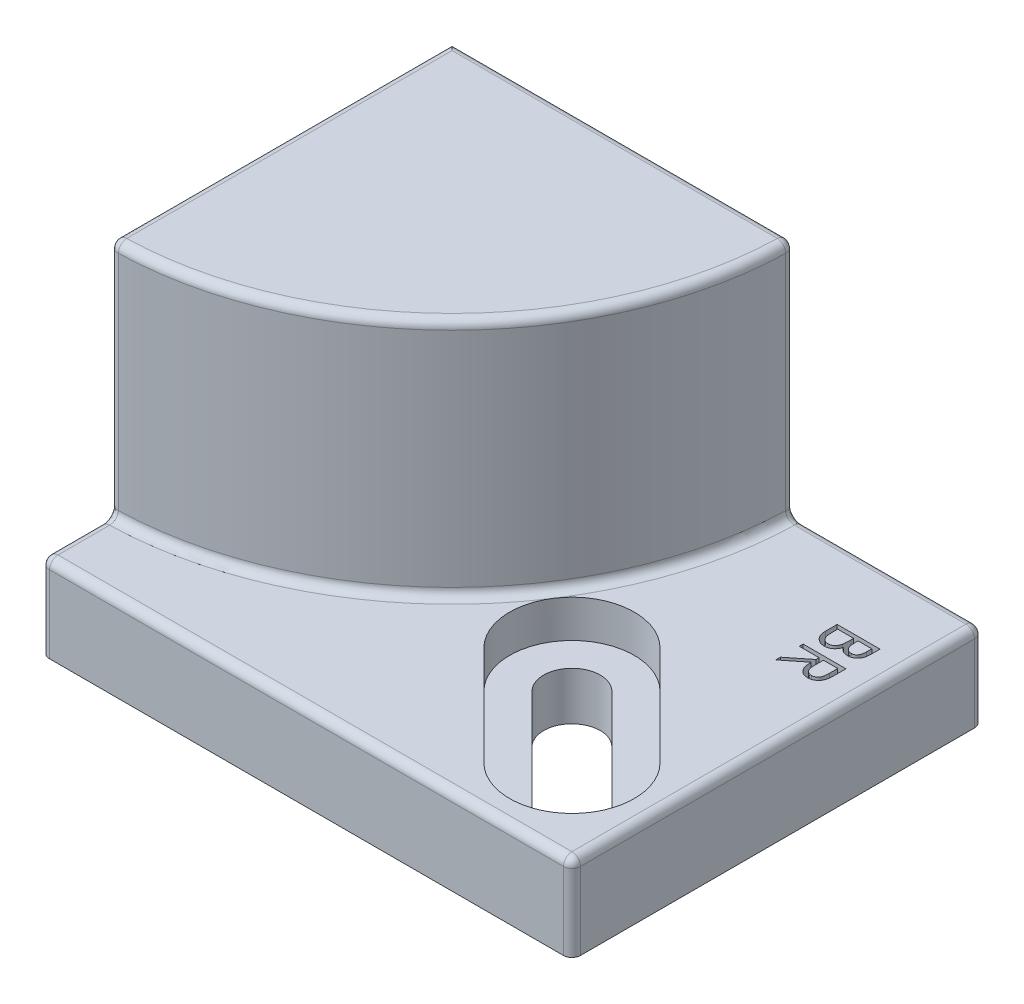
from build123d import *

# Parameters (mm, degrees)
SKETCH3_W                               = 62
SKETCH3_H                               = 48
BOSS_EXTRUDE1_DEPTH                     = 10
CBORE_FOR_M6_HEX_HEAD_BOLT1_D           = 6.6
CBORE_FOR_M6_HEX_HEAD_BOLT1_CBORE_D     = 14.55
CBORE_FOR_M6_HEX_HEAD_BOLT1_CBORE_DEPTH = 4.38
BOSS_EXTRUDE3_DEPTH                     = 18
BOSS_EXTRUDE4_DEPTH                     = 10
SKETCH10_R                              = 3
CUT_EXTRUDE2_DEPTH                      = 6
FILLET1_R                               = 1
CUT_EXTRUDE3_DEPTH                      = 4.38
CUT_EXTRUDE4_DEPTH                      = 51.847462188
CUT_EXTRUDE5_DEPTH                      = 2


with BuildPart() as part:
    # Sketch3 → Boss-Extrude1 (new body)
    with BuildSketch(Plane(origin=(0, 0, 0), x_dir=(1, 0, 0), z_dir=(0, 1, 0))):
        Rectangle(SKETCH3_W, SKETCH3_H)
    extrude(amount=BOSS_EXTRUDE1_DEPTH)

    # CBORE for M6 Hex Head Bolt1 (through all)
    with Locations(Plane(origin=(0, 10, 0), x_dir=(1, 0, 0), z_dir=(0, 1, 0))):
        with Locations((21, -14)):
            CounterBoreHole(CBORE_FOR_M6_HEX_HEAD_BOLT1_D / 2, CBORE_FOR_M6_HEX_HEAD_BOLT1_CBORE_D / 2, CBORE_FOR_M6_HEX_HEAD_BOLT1_CBORE_DEPTH)

    # Sketch8 → Boss-Extrude3 (add)
    with BuildSketch(Plane(origin=(0, 10, 0), x_dir=(1, 0, 0), z_dir=(0, 1, 0))):
        with BuildLine():
            Line((9, 24), (-1, 24))
            ThreePointArc((-1, 24), (-9.786796564, 2.786796564), (-31, -6))
            Line((-31, -6), (-31, -16))
            ThreePointArc((-31, -16), (-2.715728753, -4.284271247), (9, 24))
        make_face()
    extrude(amount=BOSS_EXTRUDE3_DEPTH)

    # Sketch9 → Boss-Extrude4 (add)
    with BuildSketch(Plane(origin=(0, 28, 0), x_dir=(1, 0, 0), z_dir=(0, 1, 0))):
        with BuildLine():
            Line((9, 24), (-31, 24))
            Line((-31, 24), (-31, -16))
            ThreePointArc((-31, -16), (-2.715728753, -4.284271247), (9, 24))
        make_face()
    extrude(amount=BOSS_EXTRUDE4_DEPTH)

    # Sketch10 → Cut-Extrude2 (cut)
    with BuildSketch(Plane(origin=(0, 10, 0), x_dir=(1, 0, 0), z_dir=(0, 1, 0))):
        with Locations(Location((-18.5, 11.5, 0), (0, 0, 270))):
            Circle(SKETCH10_R)
    extrude(amount=-CUT_EXTRUDE2_DEPTH, mode=Mode.SUBTRACT)

    # Fillet1
    fillet1_edges = [part.edges().sort_by_distance(p)[0] for p in [
        (-31, 10, -9),
        (0, 10, 24),
        (-16, 10, -24),
        (-31, 10, 20),
        (-2.715728753, 10, 4.284271247),
        (-31, 24, 16),
        (9, 24, -24),
        (-9.786796564, 10, -2.786796564),
        (-1, 19, -24),
        (-31, 19, 6),
        (-9.786796564, 28, -2.786796564),
        (-31, 28, -9),
        (-16, 28, -24),
        (-31, 38, -4),
        (-2.715728753, 38, 4.284271247),
        (-11, 38, -24),
        (31, 10, 0),
        (31, 5, 24),
        (-31, 5, 24),
        (31, 5, -24),
        (20, 10, -24),
    ]]
    fillet(fillet1_edges, radius=FILLET1_R)

    # Sketch12 → Cut-Extrude3 (cut)
    with BuildSketch(Plane(origin=(0, 10, 0), x_dir=(1, 0, 0), z_dir=(0, 1, 0))):
        with BuildLine():
            Line((15.855798167, -19.144201833), (4.26594352, -7.554347186))
            ThreePointArc((4.26594352, -7.554347186), (4.26594352, 2.73405648), (14.554347186, 2.73405648))
            Line((14.554347186, 2.73405648), (26.144201833, -8.855798167))
            ThreePointArc((26.144201833, -8.855798167), (26.144201833, -19.144201833), (15.855798167, -19.144201833))
        make_face()
    extrude(amount=-CUT_EXTRUDE3_DEPTH, mode=Mode.SUBTRACT)

    # Sketch13 → Cut-Extrude4 (cut, through all)
    with BuildSketch(Plane(origin=(0, 5.62, 0), x_dir=(1, 0, 0), z_dir=(0, 1, 0))):
        with BuildLine():
            Line((7.076692975, -4.743597731), (18.666547622, -16.333452378))
            ThreePointArc((18.666547622, -16.333452378), (23.333452378, -16.333452378), (23.333452378, -11.666547622))
            Line((23.333452378, -11.666547622), (11.743597731, -0.076692975))
            ThreePointArc((11.743597731, -0.076692975), (7.076692975, -0.076692975), (7.076692975, -4.743597731))
        make_face()
    extrude(amount=-CUT_EXTRUDE4_DEPTH, mode=Mode.SUBTRACT)

    # Sketch14 → Cut-Extrude5 (cut)
    # profile 1 of 2: a face of its own
    with BuildSketch(Plane(origin=(0, 10, 0), x_dir=(1, 0, 0), z_dir=(0, 1, 0))):
        with BuildLine():
            Line((27.508184608, 11.487179487), (27.508184608, 10.486578526))
            add(Edge.make_bspline(
                [(27.508184608, 10.486578526), (27.507962342, 10.419805485), (27.507535568, 10.29159385), (27.505155906, 10.10791775), (27.498335398, 9.941021897), (27.492465993, 9.790993555), (27.48176322, 9.657835476), (27.471533724, 9.541139347), (27.45814278, 9.441442636), (27.445706462, 9.38109142), (27.440075634, 9.353766026)],
                knots=[0, 0, 0, 0, 1.410062039, 2.707475311, 3.878576406, 4.937260626, 5.877586885, 6.699081471, 7.410979367, 8, 8, 8, 8], degree=3))
            add(Edge.make_bspline(
                [(27.440075634, 9.353766026), (27.431038423, 9.31718449), (27.413156789, 9.244801801), (27.375342484, 9.140596769), (27.331655043, 9.041256104), (27.279944246, 8.947152603), (27.22111204, 8.858277536), (27.154814691, 8.774763973), (27.080714571, 8.697089386), (27.000703886, 8.624656105), (26.914084517, 8.558997667), (26.822118276, 8.502178879), (26.725380356, 8.453525237), (26.62353388, 8.414683571), (26.517439793, 8.383436642), (26.406171694, 8.361397139), (26.290226999, 8.348181715), (26.211144333, 8.34683613), (26.171045185, 8.346153846)],
                knots=[0, 0, 0, 0, 1.02737288, 2.032829108, 3.019628684, 3.985738875, 4.958353778, 5.924249254, 6.890702889, 7.883913451, 8.865824512, 9.85161466, 10.829249435, 11.81541824, 12.821369441, 13.843154991, 14.906364023, 16, 16, 16, 16], degree=3))
            add(Edge.make_bspline(
                [(26.171045185, 8.346153846), (26.10442353, 8.34825236), (25.974427427, 8.352347105), (25.785770095, 8.390526586), (25.609781444, 8.453061689), (25.446706389, 8.539248065), (25.299637788, 8.648952242), (25.170899543, 8.780791717), (25.062174229, 8.934093194), (24.987579081, 9.077476843), (24.939581365, 9.204194534), (24.905640462, 9.308822634), (24.879859066, 9.423040869), (24.85642738, 9.545210603), (24.838547121, 9.67627549), (24.825848739, 9.815971595), (24.817683583, 9.964648308), (24.816490619, 10.066562253), (24.815876916, 10.118990385)],
                knots=[0, 0, 0, 0, 1.260402266, 2.459371274, 3.627181936, 4.786749125, 5.93865593, 7.087644312, 8.261344208, 9.485713728, 10.136162886, 10.825977872, 11.566646758, 12.35154167, 13.181268117, 14.0701832, 15.007234106, 16, 16, 16, 16], degree=3))
            Line((24.815876916, 10.118990385), (22.508184608, 8.282051282))
            Line((22.508184608, 8.282051282), (22.508184608, 8.836939103))
            Line((22.508184608, 8.836939103), (24.815876916, 10.673878205))
            Line((24.815876916, 10.673878205), (24.815876916, 11.038461538))
            Line((24.815876916, 11.038461538), (22.508184608, 11.038461538))
            Line((22.508184608, 11.038461538), (22.508184608, 11.487179487))
            Line((22.508184608, 11.487179487), (27.508184608, 11.487179487))
        make_face()
        with BuildLine():
            Line((26.995364095, 11.038461538), (25.328697429, 11.038461538))
            Line((25.328697429, 11.038461538), (25.321686211, 10.122996795))
            add(Edge.make_bspline(
                [(25.321686211, 10.122996795), (25.321667301, 10.080253882), (25.32163065, 9.997405944), (25.327336042, 9.877547849), (25.333826503, 9.765947698), (25.343754119, 9.66303231), (25.356548576, 9.568755864), (25.372552614, 9.483164981), (25.391199151, 9.406121575), (25.420055527, 9.316262501), (25.465799297, 9.215951765), (25.532239516, 9.106800274), (25.616347552, 9.014164312), (25.710995217, 8.934294158), (25.817198627, 8.872773798), (25.930243812, 8.827997769), (26.049154817, 8.799898315), (26.13082888, 8.796557687), (26.172046788, 8.794871795)],
                knots=[0, 0, 0, 0, 1.14660753, 2.222451964, 3.218720504, 4.145691244, 4.995719623, 5.770487122, 6.480909919, 7.121111896, 8.299844659, 9.430703709, 10.534634535, 11.641396424, 12.741395289, 13.810956493, 14.895269934, 16, 16, 16, 16], degree=3))
            add(Edge.make_bspline(
                [(26.172046788, 8.794871795), (26.212267329, 8.79656287), (26.291969767, 8.799913963), (26.408331819, 8.828052212), (26.518941621, 8.873491371), (26.621690877, 8.937207589), (26.715736579, 9.014198864), (26.795092175, 9.105637453), (26.861547861, 9.206918394), (26.903705209, 9.301647283), (26.929603137, 9.386258935), (26.9478048, 9.459733373), (26.962551727, 9.543068758), (26.974017184, 9.636065375), (26.984334785, 9.738554976), (26.991024444, 9.850818199), (26.995067675, 9.972725403), (26.995262989, 10.057221377), (26.995364095, 10.100961538)],
                knots=[0, 0, 0, 0, 1.100801541, 2.181386982, 3.260112282, 4.364594493, 5.481957178, 6.577424609, 7.668452592, 8.790448866, 9.403819393, 10.091598921, 10.863153553, 11.720938239, 12.658472417, 13.685008818, 14.801622349, 16, 16, 16, 16], degree=3))
            Line((26.995364095, 10.100961538), (26.995364095, 11.038461538))
        make_face(mode=Mode.SUBTRACT)
    # profile 2 of 2: a face of its own
    with BuildSketch(Plane(origin=(0, 10, 0), x_dir=(1, 0, 0), z_dir=(0, 1, 0))):
        with BuildLine():
            Line((27.508184608, 15.461538462), (27.508184608, 14.485977564))
            add(Edge.make_bspline(
                [(27.508184608, 14.485977564), (27.507933536, 14.438222595), (27.507446896, 14.34566158), (27.499899566, 14.211062378), (27.489608609, 14.084992648), (27.473279905, 13.967415831), (27.453577366, 13.858386256), (27.429717629, 13.757575346), (27.401108181, 13.665303671), (27.355613493, 13.555142619), (27.288008967, 13.429541675), (27.188111017, 13.293543971), (27.065921784, 13.1772522), (26.928089419, 13.076986033), (26.776466888, 12.997270148), (26.614668047, 12.939599723), (26.444779844, 12.903088473), (26.328146733, 12.899333566), (26.269202236, 12.897435897)],
                knots=[0, 0, 0, 0, 1.001505555, 1.941167018, 2.826882275, 3.653841531, 4.429895133, 5.150066043, 5.825578002, 6.45369114, 7.647487171, 8.808567382, 9.977351308, 11.170798116, 12.373658725, 13.556498008, 14.765093433, 16, 16, 16, 16], degree=3))
            add(Edge.make_bspline(
                [(26.269202236, 12.897435897), (26.213974944, 12.898967454), (26.105448106, 12.901977108), (25.946971293, 12.931736611), (25.795493363, 12.976044266), (25.652881724, 13.04036589), (25.520969246, 13.123103404), (25.400539879, 13.222668452), (25.294512128, 13.341213656), (25.235483952, 13.430173173), (25.205500313, 13.475360577)],
                knots=[0, 0, 0, 0, 1.044266239, 2.052081639, 3.041743201, 4.026043445, 5.00270663, 5.980942822, 6.97441044, 8, 8, 8, 8], degree=3))
            add(Edge.make_bspline(
                [(25.205500313, 13.475360577), (25.18371, 13.418550453), (25.142019734, 13.309858614), (25.067910777, 13.160176736), (24.988214679, 13.030698589), (24.900721903, 12.921281657), (24.805234654, 12.829114824), (24.703665014, 12.746347095), (24.591012565, 12.677006295), (24.470485008, 12.617436703), (24.342928266, 12.570556059), (24.208925704, 12.537384927), (24.069975714, 12.517002881), (23.975267177, 12.514223585), (23.927455441, 12.512820513)],
                knots=[0, 0, 0, 0, 1.272302504, 2.434229863, 3.488457646, 4.447234501, 5.35599188, 6.26022912, 7.18267843, 8.11661068, 9.06895546, 10.019249207, 11.000057067, 12, 12, 12, 12], degree=3))
            add(Edge.make_bspline(
                [(23.927455441, 12.512820513), (23.878645901, 12.514216445), (23.782611762, 12.516962981), (23.641529046, 12.537213828), (23.506722222, 12.571535542), (23.377232794, 12.618695452), (23.253793718, 12.680594785), (23.134859024, 12.754300761), (23.023597051, 12.844010274), (22.917361866, 12.944004225), (22.821899906, 13.057258132), (22.736912254, 13.179432503), (22.666697983, 13.312284609), (22.608453531, 13.453754265), (22.563314378, 13.604781542), (22.531976684, 13.764806466), (22.510812141, 13.933863813), (22.509075314, 14.049878578), (22.508184608, 14.109375)],
                knots=[0, 0, 0, 0, 0.978404568, 1.925038397, 2.85041836, 3.763147166, 4.682162379, 5.614488577, 6.562659439, 7.54271123, 8.535210642, 9.526693784, 10.520907202, 11.541451354, 12.589717429, 13.675358278, 14.807842563, 16, 16, 16, 16], degree=3))
            Line((22.508184608, 14.109375), (22.508184608, 15.461538462))
            Line((22.508184608, 15.461538462), (27.508184608, 15.461538462))
        make_face()
        with BuildLine():
            Line((26.995364095, 15.012820513), (25.392799993, 15.012820513))
            Line((25.392799993, 15.012820513), (25.392799993, 14.711338141))
            add(Edge.make_bspline(
                [(25.392799993, 14.711338141), (25.393366557, 14.667268037), (25.394461275, 14.582115614), (25.397695958, 14.458473769), (25.406356583, 14.343991885), (25.415516623, 14.238275478), (25.42962121, 14.142033104), (25.446881262, 14.054942572), (25.464975764, 13.976221534), (25.495834626, 13.88548015), (25.540978383, 13.782580624), (25.612685212, 13.673583034), (25.695773192, 13.575932657), (25.793413999, 13.494395823), (25.900016129, 13.427113682), (26.015589085, 13.382212501), (26.135620938, 13.350364684), (26.218240181, 13.347571837), (26.260187813, 13.346153846)],
                knots=[0, 0, 0, 0, 1.156481963, 2.23455883, 3.244418989, 4.168404366, 5.01828131, 5.794834307, 6.498111525, 7.13526334, 8.307595709, 9.435046769, 10.546766856, 11.659452936, 12.760769924, 13.837671619, 14.902137667, 16, 16, 16, 16], degree=3))
            add(Edge.make_bspline(
                [(26.260187813, 13.346153846), (26.287951986, 13.346863043), (26.342414442, 13.34825421), (26.421502346, 13.360915482), (26.496836364, 13.37928711), (26.566683866, 13.407989199), (26.633030118, 13.442695957), (26.692928239, 13.487843151), (26.749659805, 13.53882964), (26.801141773, 13.598708309), (26.847269818, 13.667189221), (26.887858451, 13.744924874), (26.919875926, 13.832843472), (26.948597305, 13.928951559), (26.968526813, 14.034787261), (26.985190535, 14.149316417), (26.993661166, 14.273510615), (26.994783791, 14.359431939), (26.995364095, 14.403846154)],
                knots=[0, 0, 0, 0, 0.911752476, 1.788502045, 2.626783689, 3.45400582, 4.26402138, 5.080402872, 5.911472738, 6.767166405, 7.66795952, 8.620018292, 9.640966946, 10.73819047, 11.913090943, 13.176185384, 14.540321519, 16, 16, 16, 16], degree=3))
            Line((26.995364095, 14.403846154), (26.995364095, 15.012820513))
        make_face(mode=Mode.SUBTRACT)
        with BuildLine():
            Line((24.87997948, 15.012820513), (23.021005121, 15.012820513))
            Line((23.021005121, 15.012820513), (23.021005121, 14.373798077))
            add(Edge.make_bspline(
                [(23.021005121, 14.373798077), (23.021551417, 14.328056527), (23.02260433, 14.239895721), (23.026079178, 14.112611268), (23.033817149, 13.994956457), (23.046432105, 13.886863584), (23.059540144, 13.787381139), (23.077682304, 13.697497481), (23.098307745, 13.617074813), (23.130226593, 13.523834541), (23.179728447, 13.41877259), (23.25485281, 13.305631446), (23.34317341, 13.204035344), (23.446681899, 13.118750504), (23.558377586, 13.048325628), (23.677676265, 12.998932553), (23.800938488, 12.967173514), (23.885198226, 12.963420594), (23.927455441, 12.961538462)],
                knots=[0, 0, 0, 0, 1.159821618, 2.235403267, 3.228114831, 4.14795534, 4.994323282, 5.771256229, 6.471395042, 7.097801288, 8.267864287, 9.404187171, 10.531774336, 11.667624178, 12.792825787, 13.866573821, 14.930062559, 16, 16, 16, 16], degree=3))
            add(Edge.make_bspline(
                [(23.927455441, 12.961538462), (23.953877917, 12.961923163), (24.006296672, 12.962686362), (24.08326944, 12.974629135), (24.158163141, 12.991290083), (24.229845272, 13.015416567), (24.299482255, 13.045838108), (24.365861122, 13.084015988), (24.430569018, 13.128104207), (24.512280426, 13.197072749), (24.606457891, 13.297294021), (24.698650877, 13.439740437), (24.773005861, 13.601698557), (24.804576402, 13.719166733), (24.820884929, 13.779847756)],
                knots=[0, 0, 0, 0, 0.723503378, 1.435336582, 2.130201219, 2.824764462, 3.504949994, 4.209866579, 4.920640069, 5.648298893, 7.13757748, 8.670694625, 10.280166878, 12, 12, 12, 12], degree=3))
            add(Edge.make_bspline(
                [(24.820884929, 13.779847756), (24.825821095, 13.804175013), (24.836523721, 13.856921525), (24.84781406, 13.942932791), (24.857941862, 14.041456153), (24.865236708, 14.152070504), (24.873067599, 14.275215772), (24.87600466, 14.410852396), (24.879589499, 14.559076264), (24.879846161, 14.661922636), (24.87997948, 14.715344551)],
                knots=[0, 0, 0, 0, 0.634452549, 1.375623993, 2.216454381, 3.166361212, 4.209414599, 5.370755378, 6.634280627, 8, 8, 8, 8], degree=3))
            Line((24.87997948, 14.715344551), (24.87997948, 15.012820513))
        make_face(mode=Mode.SUBTRACT)
    extrude(amount=-CUT_EXTRUDE5_DEPTH, mode=Mode.SUBTRACT)


solid = part.part
